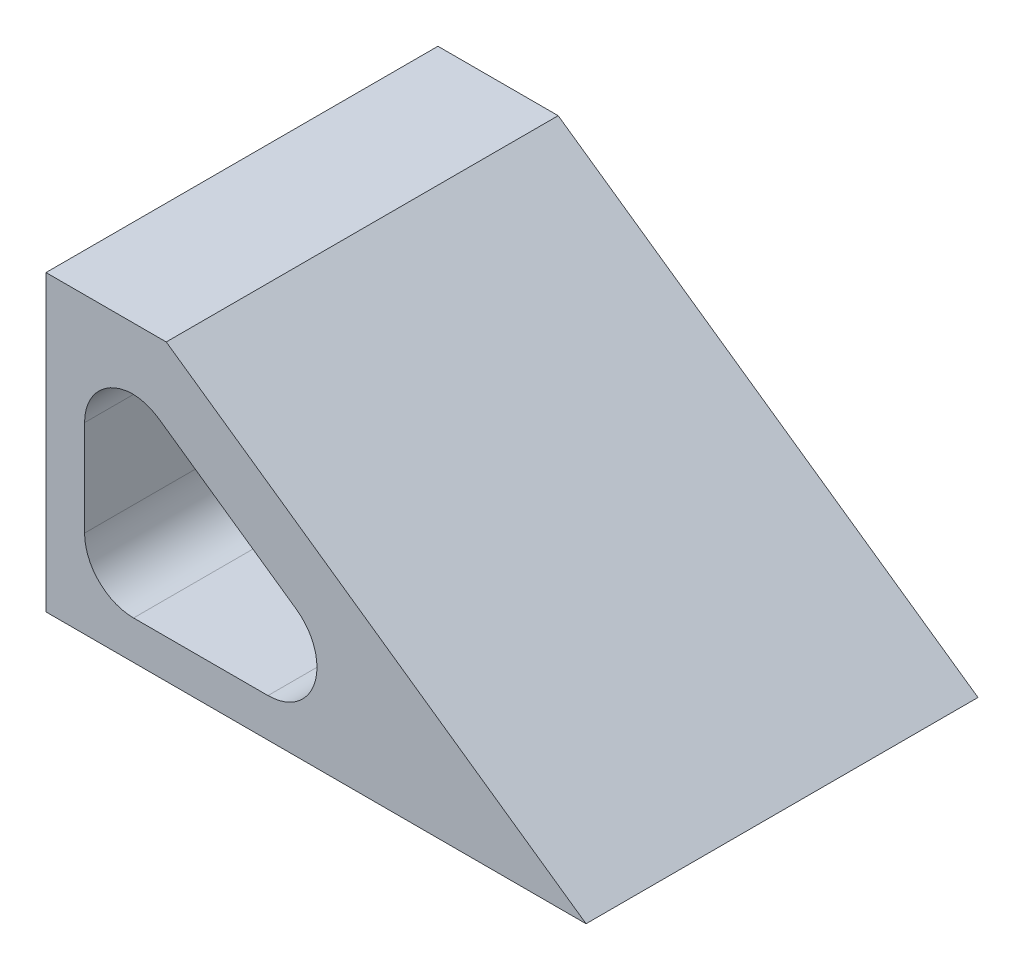
from build123d import *

# Parameters (mm, degrees)
CROQUIS1_W              = 70
CROQUIS1_H              = 50.8
SALIENTE_EXTRUIR1_DEPTH = 38.1
CORTAR_EXTRUIR5_DEPTH   = 95.510581418
CORTAR_EXTRUIR6_DEPTH   = 95.510581418


with BuildPart() as part:
    # Croquis1 → Saliente-Extruir1 (new body)
    with BuildSketch(Plane(origin=(0, 0, 0), x_dir=(1, 0, 0), z_dir=(0, 1, 0))):
        with Locations((35, 0)):
            Rectangle(CROQUIS1_W, CROQUIS1_H)
    extrude(amount=SALIENTE_EXTRUIR1_DEPTH)

    # Croquis2 → Cortar-Extruir5 (cut, through all)
    with BuildSketch(Plane.XY.offset(25.4)):
        Polygon((70, 0), (15.587560943, 38.1), (70, 38.1), align=None)
    extrude(amount=-CORTAR_EXTRUIR5_DEPTH, mode=Mode.SUBTRACT)

    # Croquis3 → Cortar-Extruir6 (cut, through all)
    with BuildSketch(Plane.XY.offset(25.4)):
        with BuildLine():
            ThreePointArc((11.206511661, 30.09837862), (6.809424544, 28.189107402), (5, 23.75))
            Line((5, 23.75), (5, 11.35))
            ThreePointArc((5, 11.35), (6.859871939, 6.859871939), (11.35, 5))
            Line((11.35, 5), (28.772058606, 5))
            ThreePointArc((28.772058606, 5), (34.828161244, 9.440518173), (32.414268977, 16.551615481))
            Line((32.414268977, 16.551615481), (14.705233694, 28.951615481))
            ThreePointArc((14.705233694, 28.951615481), (13.040811255, 29.784140775), (11.206511661, 30.09837862))
        make_face()
    extrude(amount=-CORTAR_EXTRUIR6_DEPTH, mode=Mode.SUBTRACT)


solid = part.part
